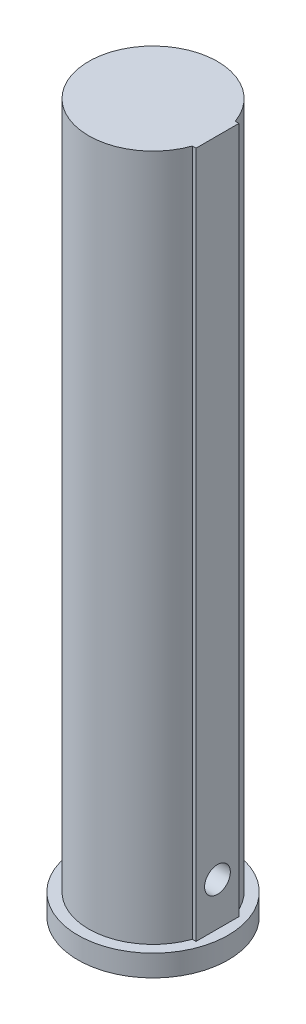
from build123d import *

# Parameters (mm, degrees)
SKETCH1_R           = 15
BOSS_EXTRUDE1_DEPTH = 160
SKETCH2_W           = 0.857864376
SKETCH2_H           = 10
BOSS_EXTRUDE2_DEPTH = 160
SKETCH6_R           = 17.5
BOSS_EXTRUDE4_DEPTH = 5
CUT_EXTRUDE1_DEPTH  = 25
SKETCH4_R           = 1.5
CUT_EXTRUDE2_DEPTH  = 15
CUT_EXTRUDE3_REACH  = 171.903
CUT_EXTRUDE3_START  = 8
SKETCH7_R           = 3


with BuildPart() as part:
    # Sketch1 → Boss-Extrude1 (new body)
    with BuildSketch(Plane(origin=(0, 0, 0), x_dir=(1, 0, 0), z_dir=(0, 1, 0))):
        with Locations(Location((0, 0, 0), (0, 0, 270))):
            Circle(SKETCH1_R)
    extrude(amount=BOSS_EXTRUDE1_DEPTH)

    # Sketch2 → Boss-Extrude2 (add)
    with BuildSketch(Plane(origin=(0, 160, 0), x_dir=(1, 0, 0), z_dir=(0, 1, 0))):
        with Locations((14.571067812, 0)):
            Rectangle(SKETCH2_W, SKETCH2_H)
    extrude(amount=-BOSS_EXTRUDE2_DEPTH)

    # Sketch6 → Boss-Extrude4 (add)
    with BuildSketch(Plane.XZ):
        with Locations(Location((0, 0, 0), (0, 0, 270))):
            Circle(SKETCH6_R)
    extrude(amount=BOSS_EXTRUDE4_DEPTH)

    # Sketch3 → Cut-Extrude1 (cut)
    with BuildSketch(Plane.XZ.offset(5)):
        with BuildLine():
            Line((1.5, -1.322875656), (1.5, 1.322875656))
            ThreePointArc((1.5, 1.322875656), (-2, 0), (1.5, -1.322875656))
        make_face()
    extrude(amount=-CUT_EXTRUDE1_DEPTH, mode=Mode.SUBTRACT)

    # Sketch4 → Cut-Extrude2 (cut)
    with BuildSketch(Plane(origin=(15, 0, 0), x_dir=(0, 0, -1), z_dir=(1, 0, 0))):
        with Locations((0, 10)):
            Circle(SKETCH4_R)
    extrude(amount=-CUT_EXTRUDE2_DEPTH, mode=Mode.SUBTRACT)

    # Sketch7 → Cut-Extrude3 (cut, up to next)
    with BuildSketch(Plane(origin=(0, 0, 0), x_dir=(0, 0, -1), z_dir=(1, 0, 0)).offset(CUT_EXTRUDE3_START), mode=Mode.PRIVATE) as cut_extrude3_sk1:
        with Locations((0, 10)):
            Circle(SKETCH7_R)
    cut_extrude3_tool1 = extrude(cut_extrude3_sk1.sketch, amount=CUT_EXTRUDE3_REACH, mode=Mode.PRIVATE) & part.part
    add(cut_extrude3_tool1.solids().sort_by_distance((8, 10, 0))[0], mode=Mode.SUBTRACT)


solid = part.part
